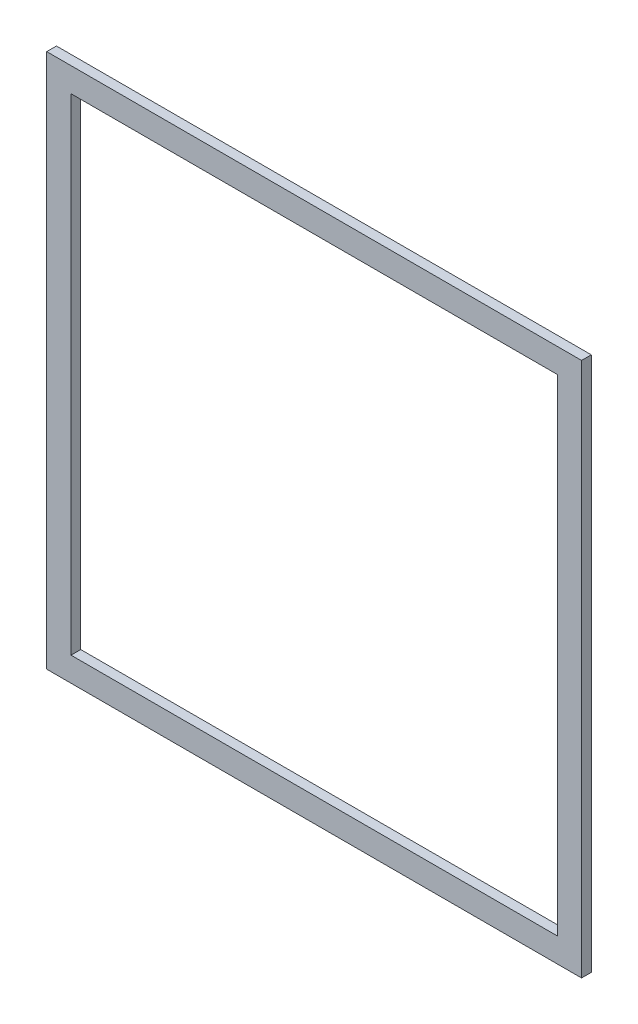
from build123d import *

# Parameters (mm, degrees)
SKETCH1_W           = 550
SKETCH1_H           = 550
SKETCH1_W_2         = 500
SKETCH1_H_2         = 500
BOSS_EXTRUDE1_DEPTH = 10


with BuildPart() as part:
    # Sketch1 → Boss-Extrude1 (new body)
    with BuildSketch(Plane.XY):
        Rectangle(SKETCH1_W, SKETCH1_H)
        Rectangle(SKETCH1_W_2, SKETCH1_H_2, mode=Mode.SUBTRACT)
    extrude(amount=BOSS_EXTRUDE1_DEPTH)


solid = part.part
